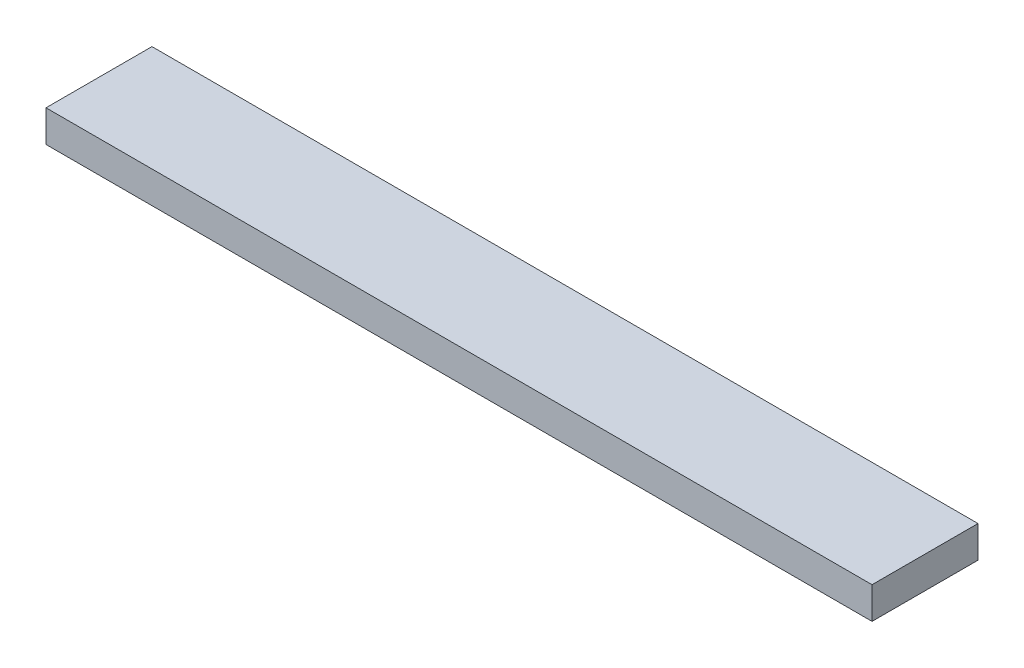
from build123d import *

# Parameters (mm, degrees)
SKETCH1_W           = 77.95
SKETCH1_H           = 10
BOSS_EXTRUDE1_DEPTH = 3


with BuildPart() as part:
    # Sketch1 → Boss-Extrude1 (new body)
    with BuildSketch(Plane(origin=(0, 0, 0), x_dir=(1, 0, 0), z_dir=(0, 1, 0))):
        with Locations((38.975, 5)):
            Rectangle(SKETCH1_W, SKETCH1_H)
    extrude(amount=BOSS_EXTRUDE1_DEPTH)


solid = part.part
